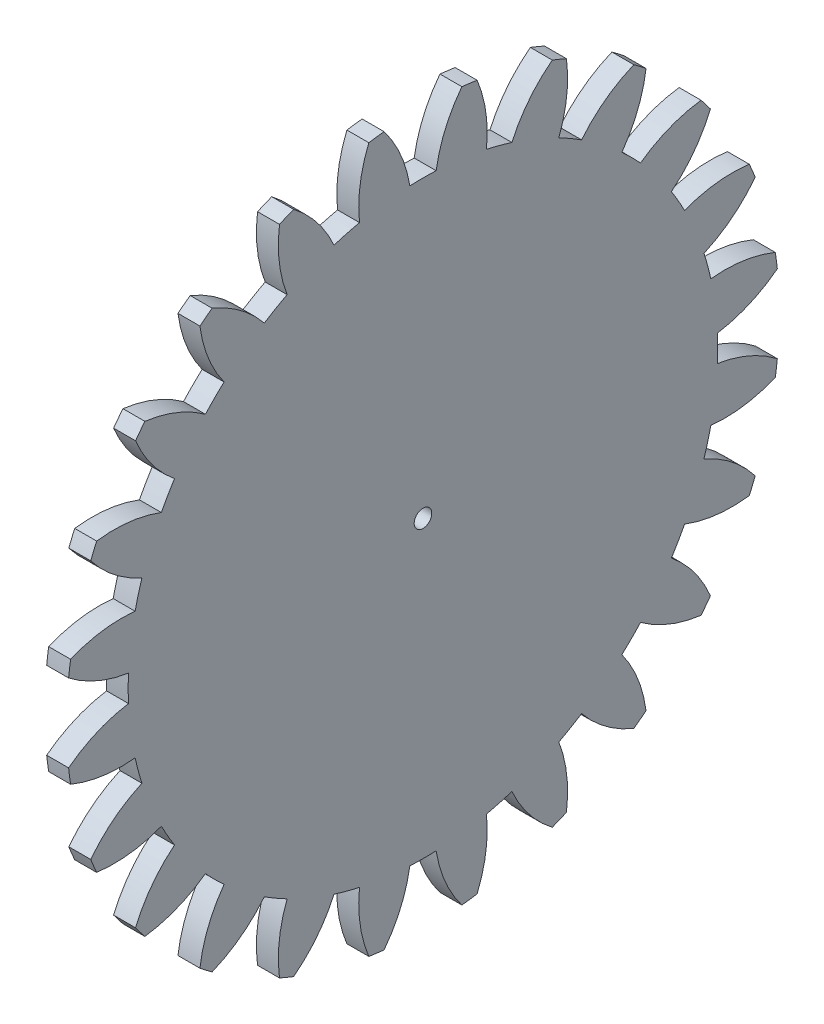
from build123d import *

# Parameters (mm, degrees)
BASPROSKE_W     = 1
BASPROSKE_H     = 16.25
TOOTHCUT_DEPTH  = 24.002717231
TEETHCUTS_COUNT = 24
BORSKE_R        = 0.4
BORE_DEPTH      = 50.0003556


with BuildPart() as part:
    # BasProSke → Base-Revolve (revolve)
    with BuildSketch(Plane(origin=(0, 0, 0), x_dir=(1, 0, 0), z_dir=(0, 1, 0)), mode=Mode.PRIVATE) as base_revolve_sk:
        with Locations((0.5, 8.125)):
            Rectangle(BASPROSKE_W, BASPROSKE_H)
    revolve(base_revolve_sk.sketch.rotate(Axis((-10, 0, 0), (1, 0, 0)), 180), axis=Axis((-10, 0, 0), (1, 0, 0)))

    # TooCutSke → ToothCut (cut, through all)
    with BuildSketch(Plane(origin=(0, 0, 0), x_dir=(0, 0, -1), z_dir=(1, 0, 0))):
        with BuildLine():
            ThreePointArc((0.600427448, 13.423077856), (0, 13.4365), (-0.600427448, 13.423077856))
            ThreePointArc((-0.600427448, 13.423077856), (-1.021266982, 14.875437681), (-1.791844283, 16.176462507))
            ThreePointArc((-1.791844283, 16.176462507), (0, 16.2754), (1.791844283, 16.176462507))
            ThreePointArc((1.791844283, 16.176462507), (1.021266982, 14.875437681), (0.600427448, 13.423077856))
        make_face()
    toothcut = extrude(amount=TOOTHCUT_DEPTH, mode=Mode.SUBTRACT)

    # TeethCuts: ToothCut ×24 about axis
    teethcuts_axis = Axis((0, 0, 0), (1, 0, 0))
    for i in range(1, TEETHCUTS_COUNT):
        add(toothcut.rotate(teethcuts_axis, i * 360 / TEETHCUTS_COUNT), mode=Mode.SUBTRACT)

    # BorSke → Bore (cut, symmetric)
    with BuildSketch(Plane(origin=(0, 0, 0), x_dir=(0, 0, -1), z_dir=(1, 0, 0))):
        with Locations(Location((0, 0, 0), (0, 0, 180))):
            Circle(BORSKE_R)
    extrude(amount=BORE_DEPTH, both=True, mode=Mode.SUBTRACT)


solid = part.part
